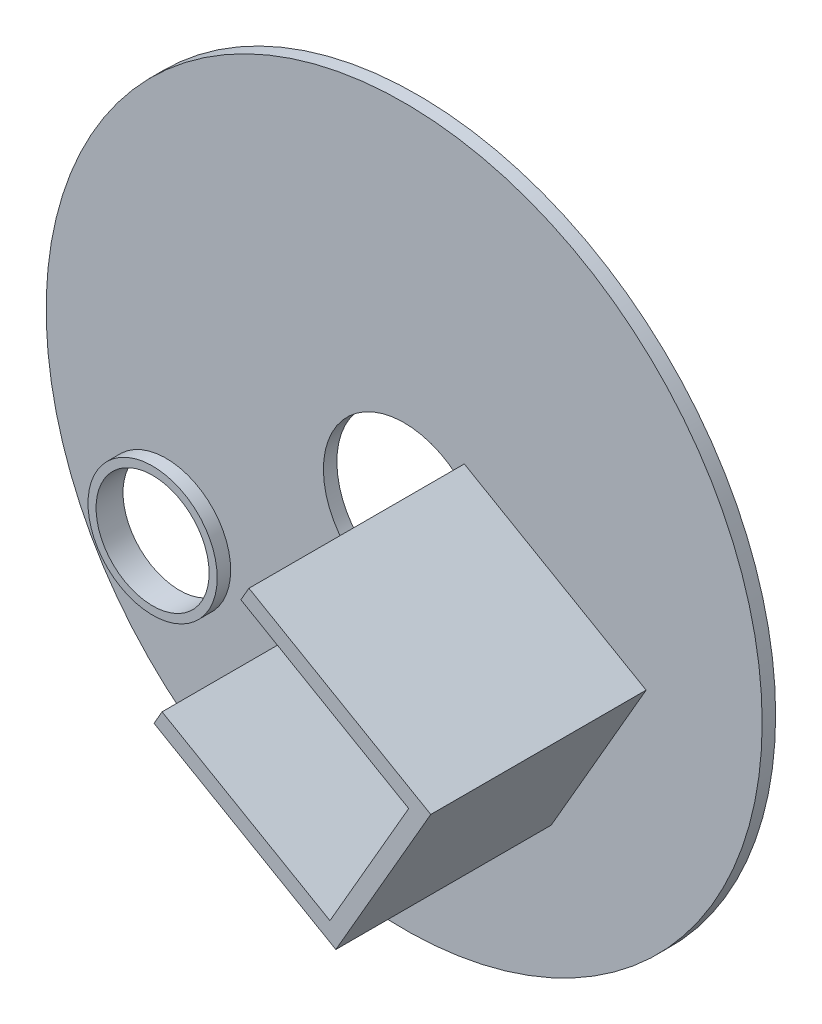
from build123d import *

# Parameters (mm, degrees)
SKETCH1_R           = 66.5
SKETCH1_R_2         = 15
BOSS_EXTRUDE1_DEPTH = 2.5
SKETCH3_R           = 10.5
CUT_EXTRUDE1_DEPTH  = 13.5
BOSS_EXTRUDE2_START = 2.5
SKETCH3_3_R         = 12
SKETCH3_3_R_2       = 10.5
BOSS_EXTRUDE2_DEPTH = 2.5
EXTRUDE_THIN1_DEPTH = 42.5


with BuildPart() as part:
    # Sketch1 → Boss-Extrude1 (new body)
    with BuildSketch(Plane.XY):
        Circle(SKETCH1_R)
        Circle(SKETCH1_R_2, mode=Mode.SUBTRACT)
    extrude(amount=BOSS_EXTRUDE1_DEPTH)

    # Sketch3 → Cut-Extrude1 (cut)
    with BuildSketch(Plane(origin=(-7.303339128, 6.698734651, 2.5), x_dir=(1, 0, 0), z_dir=(0, 0, 1))):
        with Locations((-36.92351869, -31.527257763)):
            Circle(SKETCH3_R)
    extrude(amount=-CUT_EXTRUDE1_DEPTH, mode=Mode.SUBTRACT)

    # Sketch3<3> → Boss-Extrude2 (add)
    with BuildSketch(Plane(origin=(-7.303339128, 6.698734651, 2.5), x_dir=(1, 0, 0), z_dir=(0, 0, 1)).offset(BOSS_EXTRUDE2_START)):
        with Locations((-36.92351869, -31.527257763)):
            Circle(SKETCH3_3_R)
        with Locations((-36.92351869, -31.527257763)):
            Circle(SKETCH3_3_R_2, mode=Mode.SUBTRACT)
    extrude(amount=-BOSS_EXTRUDE2_DEPTH)

    # Sketch13 → Extrude-Thin1 (add)
    with BuildSketch(Plane.XY):
        Polygon((-4.966956498, -13.990954189), (26.209958039, -31.990954189), (33.509958039, -19.346983294), (40.844851528, -6.642575102), (9.667936992, 11.357424898), (11.167336992, 13.954461879), (44.941288509, -5.544938121), (36.106995019, -20.846383294), (27.307595019, -36.08739117), (-6.466356498, -16.58799117), align=None)
    extrude(amount=EXTRUDE_THIN1_DEPTH)


solid = part.part
